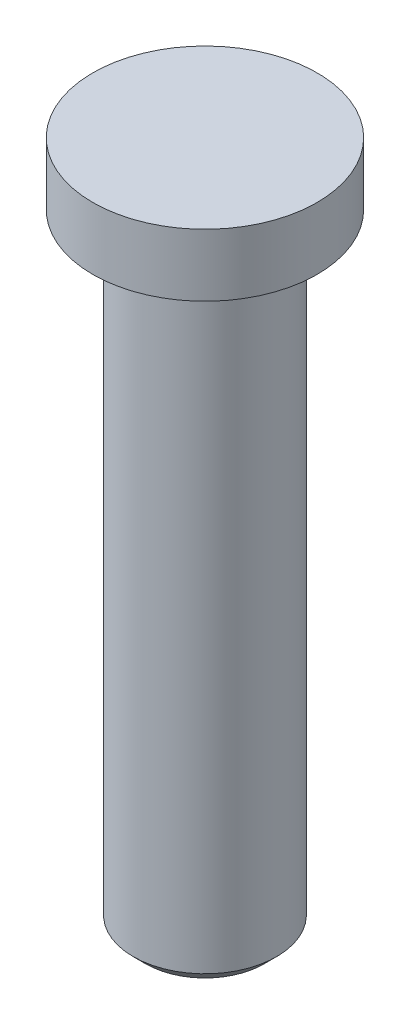
from build123d import *

# Parameters (mm, degrees)
SKETCH1_R           = 0.575
BOSS_EXTRUDE1_DEPTH = 5
SKETCH2_R           = 0.9
BOSS_EXTRUDE2_DEPTH = 0.5
CHAMFER1_SIZE       = 0.1


with BuildPart() as part:
    # Sketch1 → Boss-Extrude1 (new body)
    with BuildSketch(Plane(origin=(0, 0, 0), x_dir=(1, 0, 0), z_dir=(0, 1, 0))):
        with Locations(Location((0, 0, 0), (0, 0, 270))):
            Circle(SKETCH1_R)
    extrude(amount=BOSS_EXTRUDE1_DEPTH)

    # Sketch2 → Boss-Extrude2 (add)
    with BuildSketch(Plane(origin=(0, 5, 0), x_dir=(1, 0, 0), z_dir=(0, 1, 0))):
        with Locations(Location((0, 0, 0), (0, 0, 270))):
            Circle(SKETCH2_R)
    extrude(amount=BOSS_EXTRUDE2_DEPTH)

    # Chamfer1
    chamfer1_edges = [part.edges().sort_by_distance(p)[0] for p in [
        (0, 0, -0.575),
    ]]
    chamfer(chamfer1_edges, length=CHAMFER1_SIZE)


solid = part.part
